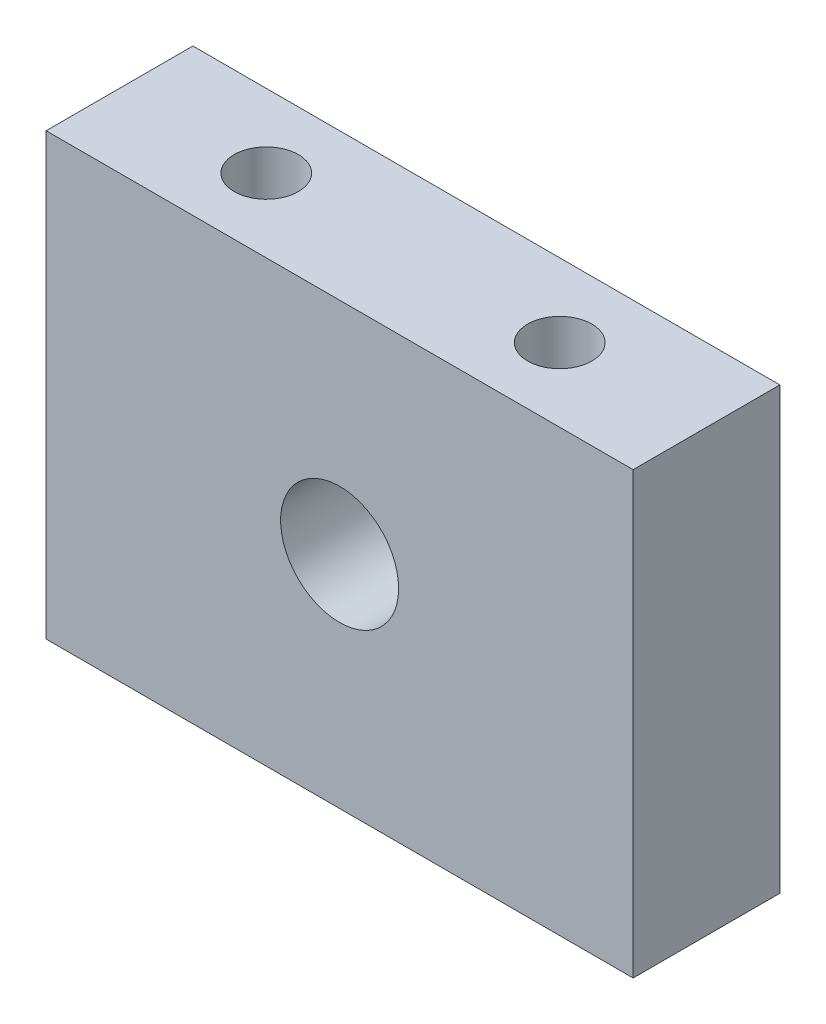
from build123d import *

# Parameters (mm, degrees)
SKETCH1_W           = 25.4
SKETCH1_H           = 19.05
BOSS_EXTRUDE1_DEPTH = 3.175
SKETCH2_R           = 2.5527
CUT_EXTRUDE1_DEPTH  = 18.097898263
SKETCH4_R           = 1.3890625
CUT_EXTRUDE2_DEPTH  = 6.35
CUT_EXTRUDE3_START  = -6.35
SKETCH5_R           = 1.3890625
CUT_EXTRUDE3_DEPTH  = 6.35


with BuildPart() as part:
    # Sketch1 → Boss-Extrude1 (new, symmetric)
    with BuildSketch(Plane.XY):
        Rectangle(SKETCH1_W, SKETCH1_H)
    extrude(amount=BOSS_EXTRUDE1_DEPTH, both=True)

    # Sketch2 → Cut-Extrude1 (cut, through all)
    with BuildSketch(Plane.XY.offset(3.175)):
        Circle(SKETCH2_R)
    extrude(amount=-CUT_EXTRUDE1_DEPTH, mode=Mode.SUBTRACT)

    # Sketch4 → Cut-Extrude2 (cut)
    with BuildSketch(Plane(origin=(0, 9.525, 0), x_dir=(1, 0, 0), z_dir=(0, 1, 0))):
        with Locations(Location((-6.35, 0, 0), (0, 0, 270))):
            Circle(SKETCH4_R)
        with Locations(Location((6.35, 0, 0), (0, 0, 90))):
            Circle(SKETCH4_R)
    extrude(amount=-CUT_EXTRUDE2_DEPTH, mode=Mode.SUBTRACT)

    # Sketch5 → Cut-Extrude3 (cut)
    with BuildSketch(Plane.XZ.offset(9.525).offset(CUT_EXTRUDE3_START)):
        with Locations(Location((6.35, 0, 0), (0, 0, 270))):
            Circle(SKETCH5_R)
        with Locations(Location((-6.35, 0, 0), (0, 0, 90))):
            Circle(SKETCH5_R)
    extrude(amount=CUT_EXTRUDE3_DEPTH, mode=Mode.SUBTRACT)


solid = part.part
